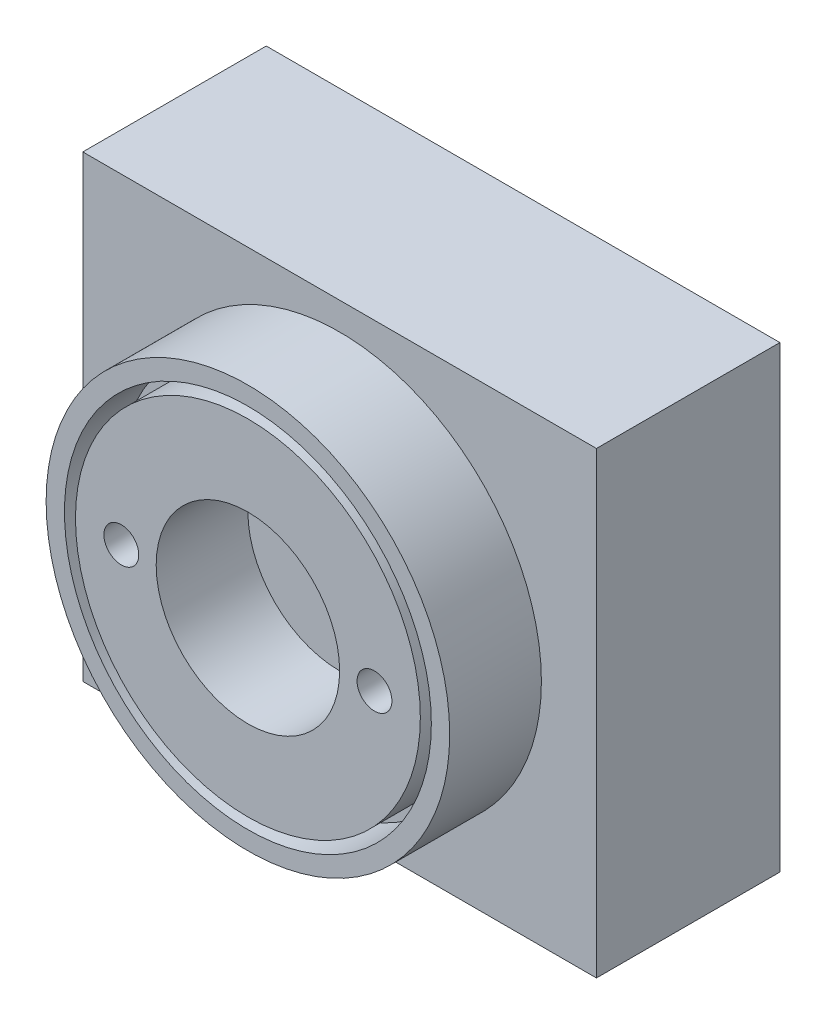
from build123d import *

# Parameters (mm, degrees)
BOSS_EXTRUDE1_DEPTH      = 10
BOSS_EXTRUDE1_DEPTH_BACK = 15
SKETCH1_R                = 55
SKETCH1_R_2              = 25
SKETCH2_R                = 50
SKETCH2_R_2              = 47
SKETCH2_R_3              = 4.75
CUT_EXTRUDE1_DEPTH       = 15
SKETCH4_W                = 140
SKETCH4_H                = 125
BOSS_EXTRUDE3_DEPTH      = 50


with BuildPart() as part:
    # Sketch1 → Boss-Extrude1 (new, two sides: drawn at the far end of the back side and taken through both)
    with BuildSketch(Plane.XY.offset(-BOSS_EXTRUDE1_DEPTH_BACK)):
        Circle(SKETCH1_R)
        Circle(SKETCH1_R_2, mode=Mode.SUBTRACT)
    extrude(amount=BOSS_EXTRUDE1_DEPTH + BOSS_EXTRUDE1_DEPTH_BACK)

    # Sketch2 → Cut-Extrude1 (cut)
    # profile 1 of 3: a face of its own
    with BuildSketch(Plane.XY.offset(10)):
        Circle(SKETCH2_R)
        Circle(SKETCH2_R_2, mode=Mode.SUBTRACT)
    # profile 2 of 3: a face of its own
    with BuildSketch(Plane.XY.offset(10)):
        with Locations((-34.5, 0)):
            Circle(SKETCH2_R_3)
    # profile 3 of 3: a face of its own
    with BuildSketch(Plane.XY.offset(10)):
        with Locations((34.5, 0)):
            Circle(SKETCH2_R_3)
    extrude(amount=-CUT_EXTRUDE1_DEPTH, mode=Mode.SUBTRACT)

    # Sketch4 → Boss-Extrude3 (add)
    with BuildSketch(Plane(origin=(0, 0, -15), x_dir=(-1, 0, 0), z_dir=(0, 0, -1))):
        Rectangle(SKETCH4_W, SKETCH4_H)
    extrude(amount=BOSS_EXTRUDE3_DEPTH)


solid = part.part
